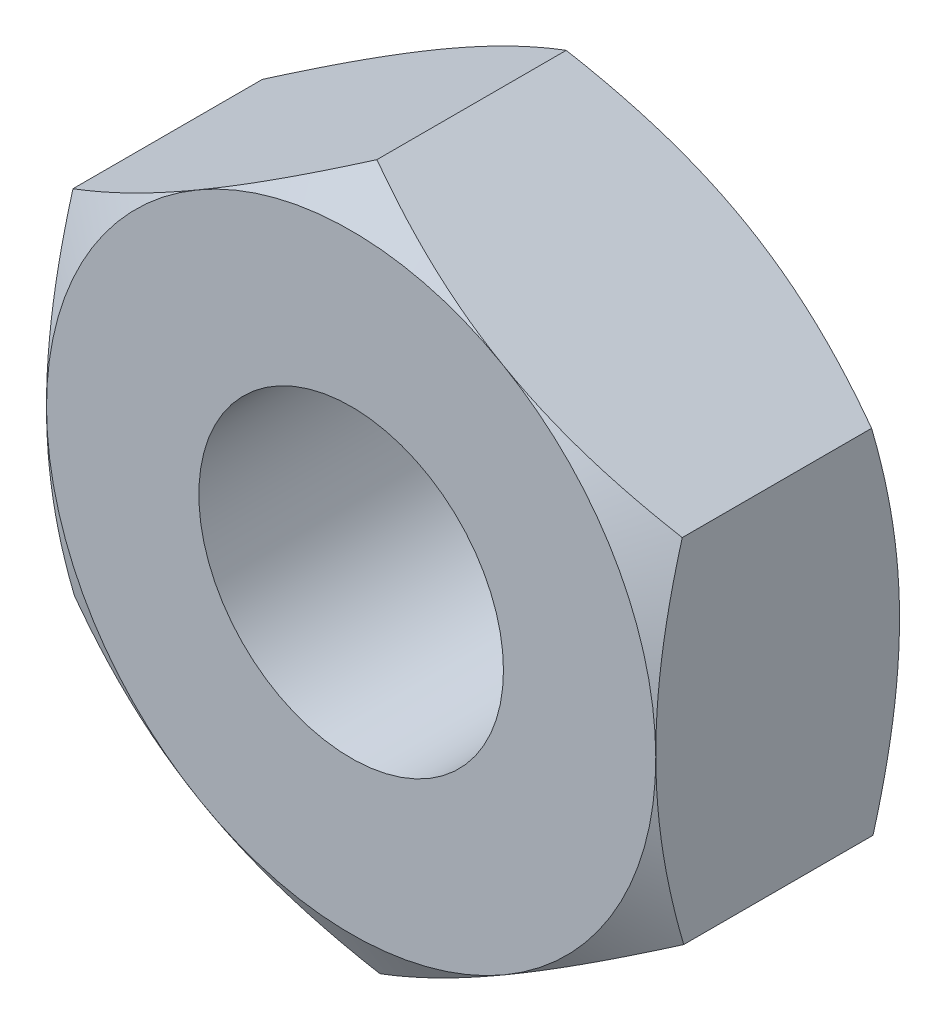
from build123d import *

# Parameters (mm, degrees)
SKETCH1_R               = 5
BOSS_EXTRUDE1_DEPTH     = 4
SKETCH2_OUTSIDE_W       = 56.08
SKETCH2_OUTSIDE_H       = 59.128
SKETCH2_OUTSIDE_R       = 10
CUT_EXTRUDE1_DEPTH      = 8
CUT_EXTRUDE1_DRAFT      = -60
MIRROR1_COPY_1_SKETCH_W = 56.08
MIRROR1_COPY_1_SKETCH_H = 59.128
MIRROR1_COPY_1_SKETCH_R = 10
MIRROR1_COPY_1_DEPTH    = 8
MIRROR1_COPY_1_DRAFT    = -60


with BuildPart() as part:
    # Sketch1 → Boss-Extrude1 (new, symmetric)
    with BuildSketch(Plane.XY):
        Polygon((10.023495122, -5.732615361), (9.976338094, 5.81429373), (-0.047157028, 11.546909091), (-10.023495122, 5.732615361), (-9.976338094, -5.81429373), (0.047157028, -11.546909091), align=None)
        Circle(SKETCH1_R, mode=Mode.SUBTRACT)
    extrude(amount=BOSS_EXTRUDE1_DEPTH, both=True)


with BuildPart() as cut_extrude1_tool:
    # Sketch2 outside → Cut-Extrude1 (with draft: the straight prism first)
    with BuildSketch(Plane(origin=(0, 0, -4), x_dir=(-1, 0, 0), z_dir=(0, 0, -1))):
        Rectangle(SKETCH2_OUTSIDE_W, SKETCH2_OUTSIDE_H)
        Circle(SKETCH2_OUTSIDE_R, mode=Mode.SUBTRACT)
    extrude(amount=-CUT_EXTRUDE1_DEPTH)
    # Cut-Extrude1: the draft: its side faces are tilted about the plane it starts from
    cut_extrude1_sides = [cut_extrude1_tool.faces().sort_by_distance(p)[0] for p in [
        (0, -29.564, 0),
        (-28.04, 0, 0),
        (0, 29.564, 0),
        (28.04, 0, 0),
        (10, 0, 0),
    ]]
    draft(cut_extrude1_sides, Plane(origin=(0, 0, -4), x_dir=(-1, 0, 0), z_dir=(0, 0, -1)), CUT_EXTRUDE1_DRAFT)


with BuildPart() as part_1:
    add(part.part)

    # Cut-Extrude1: cut by cut_extrude1_tool
    add(cut_extrude1_tool.part, mode=Mode.SUBTRACT)


with BuildPart() as mirror1_copy_1_tool:
    # Mirror1 copy 1 sketch → Mirror1 copy 1 (with draft: the straight prism first)
    with BuildSketch(Plane(origin=(0, 0, 4), x_dir=(-1, 0, 0), z_dir=(0, 0, 1))):
        Rectangle(MIRROR1_COPY_1_SKETCH_W, MIRROR1_COPY_1_SKETCH_H)
        Circle(MIRROR1_COPY_1_SKETCH_R, mode=Mode.SUBTRACT)
    extrude(amount=-MIRROR1_COPY_1_DEPTH)
    # Mirror1 copy 1: the draft: its side faces are tilted about the plane it starts from
    mirror1_copy_1_sides = [mirror1_copy_1_tool.faces().sort_by_distance(p)[0] for p in [
        (0, -29.564, 0),
        (-28.04, 0, 0),
        (0, 29.564, 0),
        (28.04, 0, 0),
        (10, 0, 0),
    ]]
    draft(mirror1_copy_1_sides, Plane(origin=(0, 0, 4), x_dir=(-1, 0, 0), z_dir=(0, 0, 1)), MIRROR1_COPY_1_DRAFT)


with BuildPart() as part_2:
    add(part_1.part)

    # Mirror1 copy 1: cut by mirror1_copy_1_tool
    add(mirror1_copy_1_tool.part, mode=Mode.SUBTRACT)


solid = part_2.part
